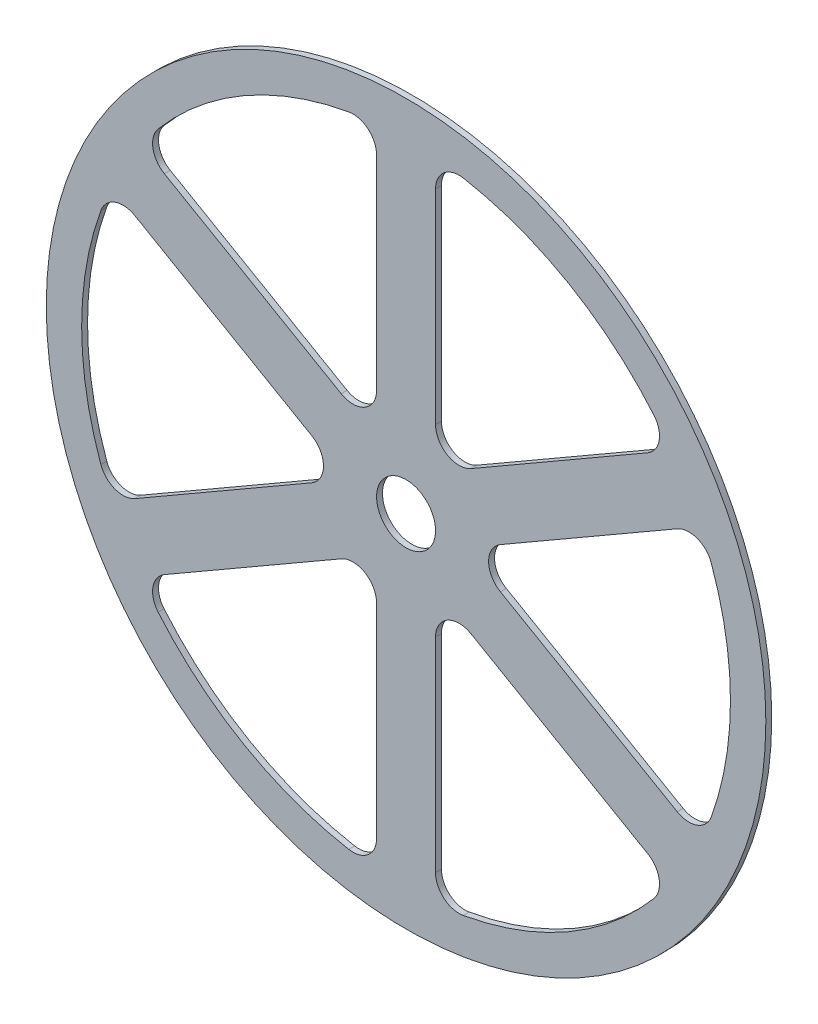
from build123d import *

# Parameters (mm, degrees)
SKETCH1_R             = 193.675
SKETCH1_R_2           = 174.625
BOSS_EXTRUDE1_DEPTH   = 3.175
SKETCH1_R_3           = 34.925
SKETCH1_R_4           = 15.875
BOSS_EXTRUDE1_2_DEPTH = 3.175
BOSS_EXTRUDE2_START   = -3.175
SKETCH2_R             = 15.875
BOSS_EXTRUDE2_DEPTH   = 3.175


with BuildPart() as part:
    # Sketch1 → Boss-Extrude1 (new body)
    with BuildSketch(Plane.XY):
        Circle(SKETCH1_R)
        Circle(SKETCH1_R_2, mode=Mode.SUBTRACT)
    extrude(amount=BOSS_EXTRUDE1_DEPTH)



with BuildPart() as body_2:
    # Sketch1 → Boss-Extrude1 2 (new body)
    with BuildSketch(Plane.XY):
        Circle(SKETCH1_R_3)
        Circle(SKETCH1_R_4, mode=Mode.SUBTRACT)
    extrude(amount=BOSS_EXTRUDE1_2_DEPTH)


with BuildPart() as part_1:
    add(part.part)

    add(body_2.part)  # Boss-Extrude2 merges body 2
    # Sketch2 → Boss-Extrude2 (add)
    with BuildSketch(Plane.XY.offset(3.175).offset(BOSS_EXTRUDE2_START)):
        with BuildLine():
            Line((15.875, 49.493351826), (15.875, 159.383735055))
            ThreePointArc((15.875, 159.383735055), (20.425550361, 169.124190413), (30.816176471, 171.884420157))
            ThreePointArc((30.816176471, 171.884420157), (0, 174.625), (-30.816176471, 171.884420157))
            ThreePointArc((-30.816176471, 171.884420157), (-20.425550361, 169.124190413), (-15.875, 159.383735055))
            Line((-15.875, 159.383735055), (-15.875, 49.493351826))
            ThreePointArc((-15.875, 49.493351826), (-22.225, 38.494829198), (-34.925, 38.494829198))
            Line((-34.925, 38.494829198), (-130.092863507, 93.440020812))
            ThreePointArc((-130.092863507, 93.440020812), (-136.253070112, 102.251140706), (-133.448186135, 112.62980175))
            ThreePointArc((-133.448186135, 112.62980175), (-151.229686136, 87.3125), (-164.264362606, 59.254618408))
            ThreePointArc((-164.264362606, 59.254618408), (-156.678620473, 66.873049707), (-145.967863507, 65.943714242))
            Line((-145.967863507, 65.943714242), (-50.8, 10.998522628))
            ThreePointArc((-50.8, 10.998522628), (-44.45, 0), (-50.8, -10.998522628))
            Line((-50.8, -10.998522628), (-145.967863507, -65.943714242))
            ThreePointArc((-145.967863507, -65.943714242), (-156.678620473, -66.873049707), (-164.264362606, -59.254618408))
            ThreePointArc((-164.264362606, -59.254618408), (-151.229686136, -87.3125), (-133.448186135, -112.62980175))
            ThreePointArc((-133.448186135, -112.62980175), (-136.253070112, -102.251140706), (-130.092863507, -93.440020812))
            Line((-130.092863507, -93.440020812), (-34.925, -38.494829198))
            ThreePointArc((-34.925, -38.494829198), (-22.225, -38.494829198), (-15.875, -49.493351826))
            Line((-15.875, -49.493351826), (-15.875, -159.383735055))
            ThreePointArc((-15.875, -159.383735055), (-20.425550361, -169.124190413), (-30.816176471, -171.884420157))
            ThreePointArc((-30.816176471, -171.884420157), (0, -174.625), (30.816176471, -171.884420157))
            ThreePointArc((30.816176471, -171.884420157), (20.425550361, -169.124190413), (15.875, -159.383735055))
            Line((15.875, -159.383735055), (15.875, -49.493351826))
            ThreePointArc((15.875, -49.493351826), (22.225, -38.494829198), (34.925, -38.494829198))
            Line((34.925, -38.494829198), (130.092863507, -93.440020812))
            ThreePointArc((130.092863507, -93.440020812), (136.253070112, -102.251140706), (133.448186135, -112.62980175))
            ThreePointArc((133.448186135, -112.62980175), (151.229686136, -87.3125), (164.264362606, -59.254618408))
            ThreePointArc((164.264362606, -59.254618408), (156.678620473, -66.873049707), (145.967863507, -65.943714242))
            Line((145.967863507, -65.943714242), (50.8, -10.998522628))
            ThreePointArc((50.8, -10.998522628), (44.45, 0), (50.8, 10.998522628))
            Line((50.8, 10.998522628), (145.967863507, 65.943714242))
            ThreePointArc((145.967863507, 65.943714242), (156.678620473, 66.873049707), (164.264362606, 59.254618408))
            ThreePointArc((164.264362606, 59.254618408), (151.229686136, 87.3125), (133.448186135, 112.62980175))
            ThreePointArc((133.448186135, 112.62980175), (136.253070112, 102.251140706), (130.092863507, 93.440020812))
            Line((130.092863507, 93.440020812), (34.925, 38.494829198))
            ThreePointArc((34.925, 38.494829198), (22.225, 38.494829198), (15.875, 49.493351826))
        make_face()
        Circle(SKETCH2_R, mode=Mode.SUBTRACT)
    extrude(amount=BOSS_EXTRUDE2_DEPTH)


solid = part_1.part
